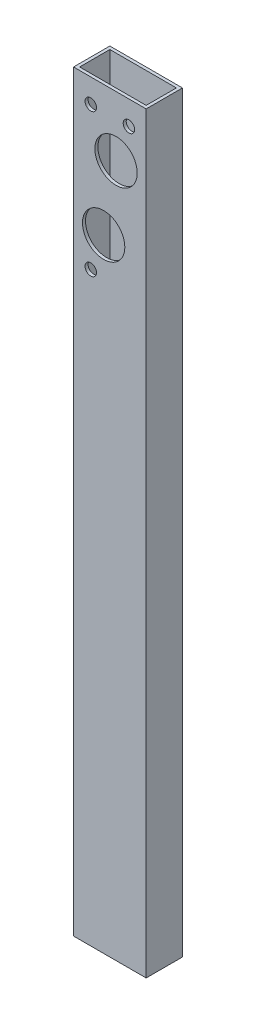
from build123d import *

# Parameters (mm, degrees)
EXTRUDE_THIN1_DEPTH            = 510
EXTRUDE_THIN1_DEPTH_BACK       = 280
SKETCH1_W                      = 76.2
SKETCH1_H                      = 38.1
SKETCH1_W_2                    = 69.85
SKETCH1_H_2                    = 31.75
CUT_EXTRUDE1_REACH             = 514.838
SKETCH6_R                      = 22.225
F_12_0_12_DIAMETER_HOLE2_D     = 12
F_12_0_12_DIAMETER_HOLE2_DEPTH = 3.175
F_12_0_12_DIAMETER_HOLE1_D     = 12
F_12_0_12_DIAMETER_HOLE1_DEPTH = 3.175
CUT_EXTRUDE2_REACH             = 514.838
SKETCH7_R                      = 22.225


with BuildPart() as part:
    # Sketch1 → Extrude-Thin1 (new, two sides: drawn at the far end of the back side and taken through both)
    with BuildSketch(Plane(origin=(0, 0, 0), x_dir=(1, 0, 0), z_dir=(0, 1, 0)).offset(-EXTRUDE_THIN1_DEPTH_BACK)):
        Rectangle(SKETCH1_W, SKETCH1_H)
        Rectangle(SKETCH1_W_2, SKETCH1_H_2, mode=Mode.SUBTRACT)
    extrude(amount=EXTRUDE_THIN1_DEPTH + EXTRUDE_THIN1_DEPTH_BACK)

    # Sketch6 → Cut-Extrude1 (cut, up to next)
    with BuildSketch(Plane.XY.offset(19.05), mode=Mode.PRIVATE) as cut_extrude1_sk1:
        with Locations((6.511806663, 446.930290738)):
            Circle(SKETCH6_R)
    cut_extrude1_tool1 = extrude(cut_extrude1_sk1.sketch, amount=-CUT_EXTRUDE1_REACH, mode=Mode.PRIVATE) & part.part
    # Sketch6 → Cut-Extrude1 (cut, up to next)
    with BuildSketch(Plane.XY.offset(19.05), mode=Mode.PRIVATE) as cut_extrude1_sk2:
        with Locations((-6.511806663, 373.069709262)):
            Circle(SKETCH6_R)
    cut_extrude1_tool2 = extrude(cut_extrude1_sk2.sketch, amount=-CUT_EXTRUDE1_REACH, mode=Mode.PRIVATE) & part.part
    add(cut_extrude1_tool1.solids().sort_by_distance((6.511807, 446.930291, 19.05))[0], mode=Mode.SUBTRACT)
    add(cut_extrude1_tool2.solids().sort_by_distance((-6.511807, 373.069709, 19.05))[0], mode=Mode.SUBTRACT)

    # Ø12.0 (12) Diameter Hole2
    with Locations(Plane.XY.offset(19.05)):
        with Locations((-20, 485), (20, 485), (-20, 335)):
            Hole(F_12_0_12_DIAMETER_HOLE2_D / 2, depth=F_12_0_12_DIAMETER_HOLE2_DEPTH)

    # Ø12.0 (12) Diameter Hole1
    with Locations(Plane(origin=(0, 0, -19.05), x_dir=(-1, 0, 0), z_dir=(0, 0, -1))):
        with Locations((-20, -15), (20, -255), (-20, -255), (20, -15)):
            Hole(F_12_0_12_DIAMETER_HOLE1_D / 2, depth=F_12_0_12_DIAMETER_HOLE1_DEPTH)

    # Sketch7 → Cut-Extrude2 (cut, up to next)
    with BuildSketch(Plane(origin=(0, 0, -19.05), x_dir=(-1, 0, 0), z_dir=(0, 0, -1)), mode=Mode.PRIVATE) as cut_extrude2_sk1:
        with Locations((0, -50)):
            Circle(SKETCH7_R)
    cut_extrude2_tool1 = extrude(cut_extrude2_sk1.sketch, amount=-CUT_EXTRUDE2_REACH, mode=Mode.PRIVATE) & part.part
    # Sketch7 → Cut-Extrude2 (cut, up to next)
    with BuildSketch(Plane(origin=(0, 0, -19.05), x_dir=(-1, 0, 0), z_dir=(0, 0, -1)), mode=Mode.PRIVATE) as cut_extrude2_sk2:
        with Locations((0, -220)):
            Circle(SKETCH7_R)
    cut_extrude2_tool2 = extrude(cut_extrude2_sk2.sketch, amount=-CUT_EXTRUDE2_REACH, mode=Mode.PRIVATE) & part.part
    add(cut_extrude2_tool1.solids().sort_by_distance((0, -50, -19.05))[0], mode=Mode.SUBTRACT)
    add(cut_extrude2_tool2.solids().sort_by_distance((0, -220, -19.05))[0], mode=Mode.SUBTRACT)


solid = part.part
